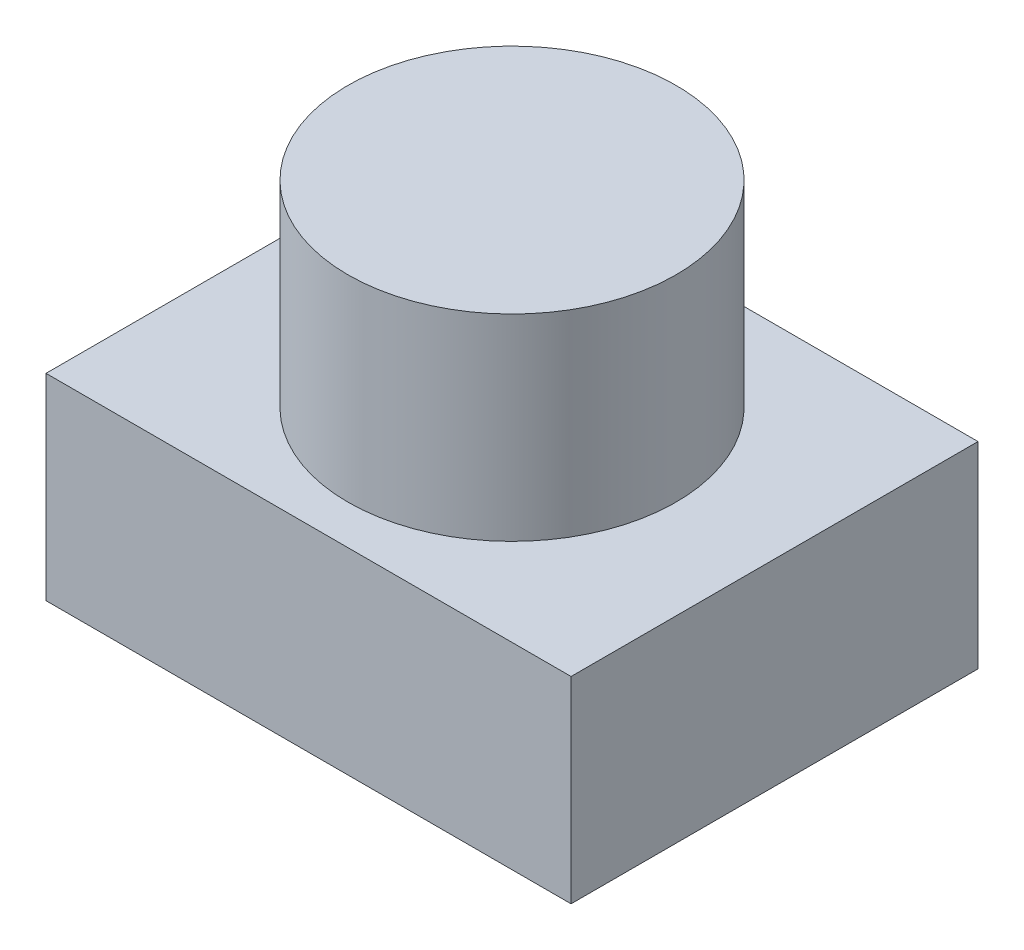
from build123d import *

# Parameters (mm, degrees)
SKETCH_1_W      = 40
SKETCH_1_H      = 31
EXTRUDE_1_DEPTH = 15
SKETCH_2_R      = 12.5
EXTRUDE_2_DEPTH = 15


with BuildPart() as part:
    # 草图1 → 凸台-拉伸1 (new body)
    with BuildSketch(Plane(origin=(0, 0, 0), x_dir=(1, 0, 0), z_dir=(0, 1, 0))):
        Rectangle(SKETCH_1_W, SKETCH_1_H)
    extrude(amount=EXTRUDE_1_DEPTH)

    # 草图2 → 凸台-拉伸2 (add)
    with BuildSketch(Plane(origin=(0, 15, 0), x_dir=(1, 0, 0), z_dir=(0, 1, 0))):
        with Locations(Location((0, 0, 0), (0, 0, 270))):
            Circle(SKETCH_2_R)
    extrude(amount=EXTRUDE_2_DEPTH)


solid = part.part
